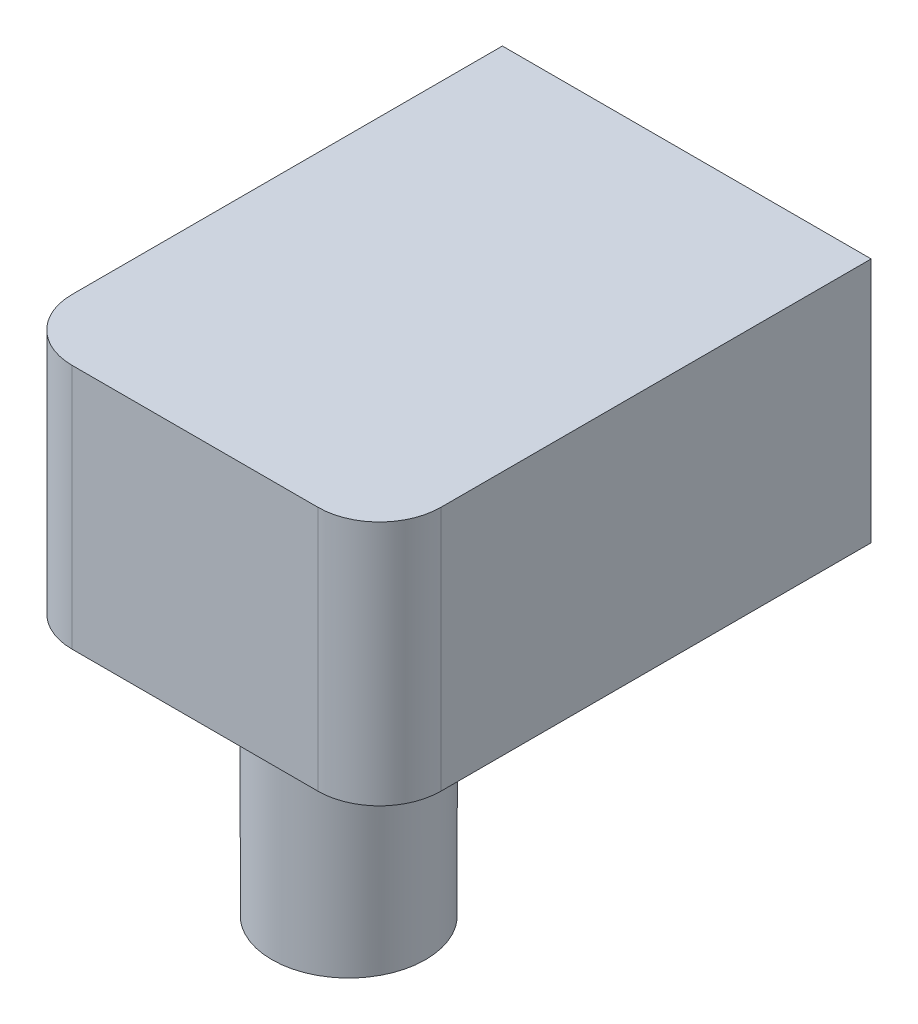
from build123d import *

# Parameters (mm, degrees)
CROQUIS1_W              = 60
CROQUIS1_H              = 40
SALIENTE_EXTRUIR1_DEPTH = 80
REDONDEO1_R             = 10
CROQUIS2_R              = 12.5
SALIENTE_EXTRUIR2_DEPTH = 40


with BuildPart() as part:
    # Croquis1 → Saliente-Extruir1 (new body)
    with BuildSketch(Plane.XY):
        Rectangle(CROQUIS1_W, CROQUIS1_H)
    extrude(amount=SALIENTE_EXTRUIR1_DEPTH)

    # Redondeo1
    redondeo1_edges = [part.edges().sort_by_distance(p)[0] for p in [
        (-30, 0, 80),
        (30, 0, 80),
    ]]
    fillet(redondeo1_edges, radius=REDONDEO1_R)

    # Croquis2 → Saliente-Extruir2 (add)
    with BuildSketch(Plane.XZ.offset(20)):
        with Locations(Location((0, 55, 0), (0, 0, 90))):
            Circle(CROQUIS2_R)
    extrude(amount=SALIENTE_EXTRUIR2_DEPTH)


solid = part.part
